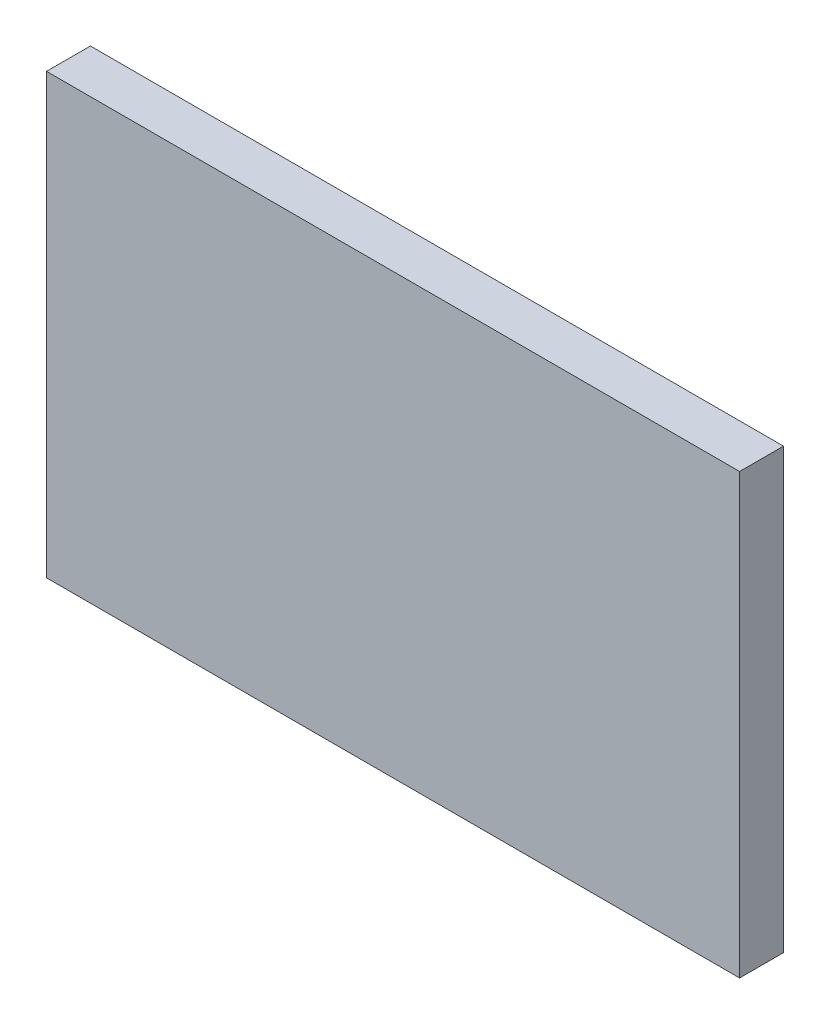
from build123d import *

# Parameters (mm, degrees)
SKETCH_1_W      = 1580
SKETCH_1_H      = 1000
EXTRUDE_1_DEPTH = 100


with BuildPart() as part:
    # Эскиз1 → Бобышка-Вытянуть1 (new body)
    with BuildSketch(Plane.XY):
        with Locations((790, -500)):
            Rectangle(SKETCH_1_W, SKETCH_1_H)
    extrude(amount=EXTRUDE_1_DEPTH)


solid = part.part
